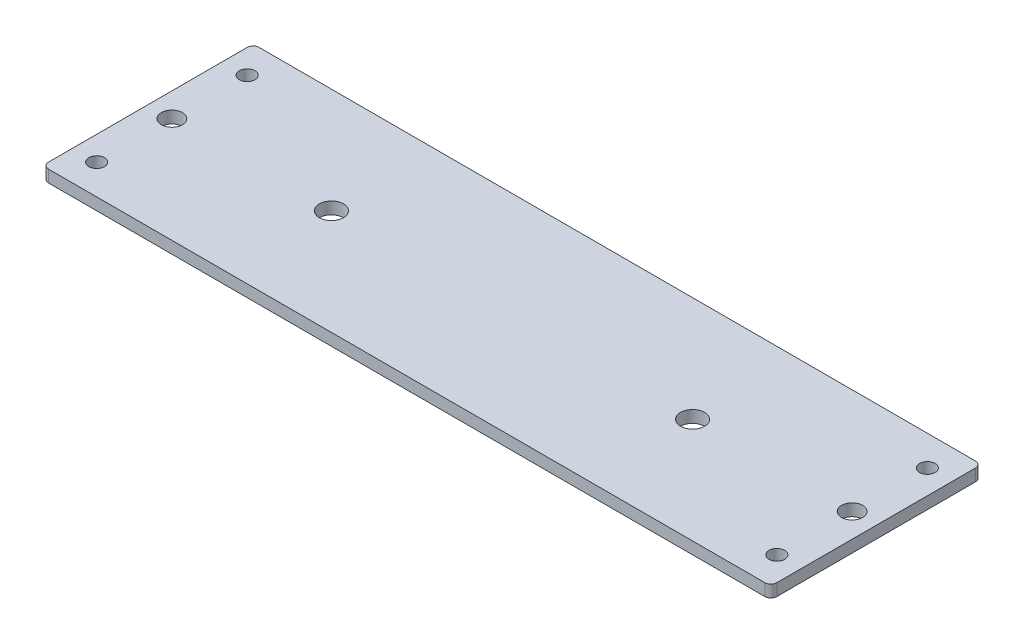
from build123d import *

# Parameters (mm, degrees)
SKETCH_1_W          = 242
SKETCH_1_H          = 70
EXTRUDE_1_DEPTH     = 4
SKETCH_2_R          = 2.6
SKETCH_2_R_2        = 4
SKETCH_2_R_3        = 3.5
CUT_EXTRUDE_1_DEPTH = 4
FILLET_1_R          = 2


with BuildPart() as part:
    # 草图1 → 凸台-拉伸1 (new body)
    with BuildSketch(Plane(origin=(0, 0, 0), x_dir=(1, 0, 0), z_dir=(0, 1, 0))):
        Rectangle(SKETCH_1_W, SKETCH_1_H)
    extrude(amount=EXTRUDE_1_DEPTH)

    # 草图2 → 切除-拉伸1 (cut)
    with BuildSketch(Plane(origin=(0, 4, 0), x_dir=(1, 0, 0), z_dir=(0, 1, 0))):
        with Locations(Location((-113, 25, 0), (0, 0, 270))):
            Circle(SKETCH_2_R)
        with Locations(Location((-113, -25, 0), (0, 0, 90))):
            Circle(SKETCH_2_R)
        with Locations(Location((113, -25, 0), (0, 0, 270))):
            Circle(SKETCH_2_R)
        with Locations(Location((113, 25, 0), (0, 0, 90))):
            Circle(SKETCH_2_R)
        with Locations(Location((-60, 0, 0), (0, 0, 270))):
            Circle(SKETCH_2_R_2)
        with Locations(Location((60, 0, 0), (0, 0, 90))):
            Circle(SKETCH_2_R_2)
        with Locations(Location((-113, 0, 0), (0, 0, 270))):
            Circle(SKETCH_2_R_3)
        with Locations(Location((113, 0, 0), (0, 0, 90))):
            Circle(SKETCH_2_R_3)
    extrude(amount=-CUT_EXTRUDE_1_DEPTH, mode=Mode.SUBTRACT)

    # 圆角1
    fillet_1_edges = [part.edges().sort_by_distance(p)[0] for p in [
        (121, 2, 35),
        (-121, 2, 35),
        (-121, 2, -35),
        (121, 2, -35),
    ]]
    fillet(fillet_1_edges, radius=FILLET_1_R)


solid = part.part
